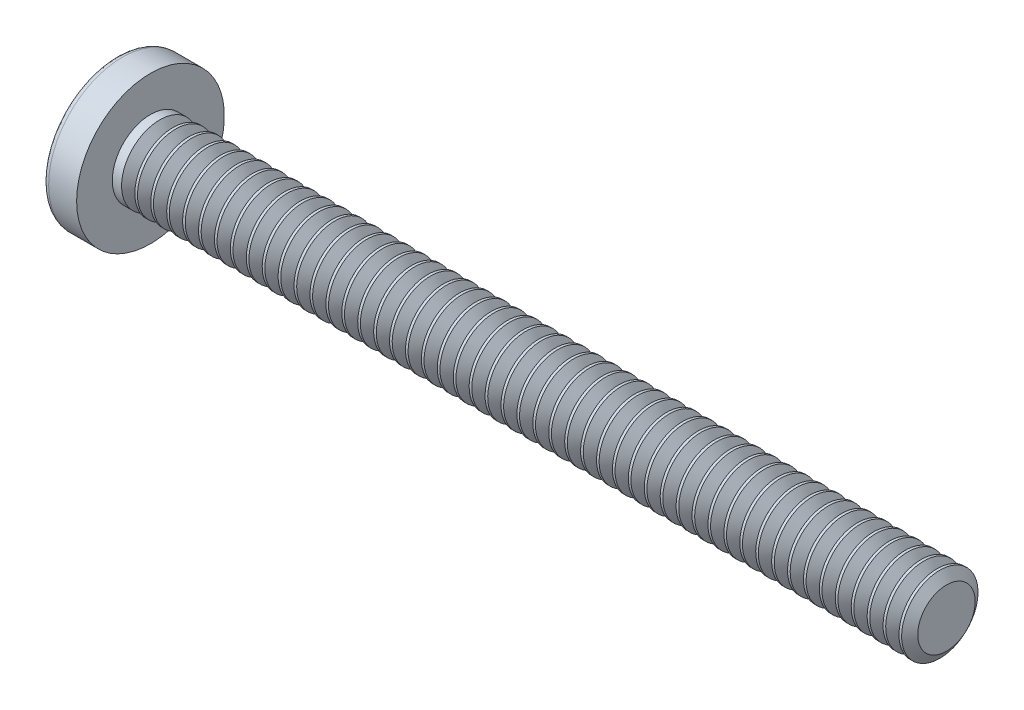
from build123d import *

# Parameters (mm, degrees)
CIRPATTERN1_COUNT = 2
CIRPATTERN1_ANGLE = 90
THDSCHPAT_COUNT   = 50
THDSCHPAT_PITCH   = 0.3175


with BuildPart() as part:
    # BodySke → Base-Revolve (revolve)
    with BuildSketch(Plane.XY, mode=Mode.PRIVATE) as base_revolve_sk:
        with BuildLine():
            Line((1.1176, 0.762), (1.1176, 1.4732))
            Line((1.1176, 1.4732), (0.559486612, 1.4732))
            ThreePointArc((0.559486612, 1.4732), (0.501455643, 1.459166396), (0.456249613, 1.420167033))
            ThreePointArc((0.456249613, 1.420167033), (0.116862787, 0.745828082), (0, 0))
            Line((0, 0), (16.9926, 0))
            Line((16.9926, 0), (16.9926, 0.762))
            Line((16.9926, 0.762), (1.1176, 0.762))
        make_face()
    revolve(base_revolve_sk.sketch.rotate(Axis((-25.4, 0, 0), (1, 0, 0)), 90), axis=Axis((-25.4, 0, 0), (1, 0, 0)))

    # Sketch3 → Cut-Loft1 section 0
    with BuildSketch(Plane(origin=(0, 0, 0), x_dir=(0, 0, -1), z_dir=(1, 0, 0))):
        with BuildLine():
            Line((0.2794, -0.9652), (-0.2794, -0.9652))
            Line((-0.2794, -0.9652), (-0.2794, 0.9652))
            Line((-0.2794, 0.9652), (0.2794, 0.9652))
            Line((0.2794, 0.9652), (0.2794, -0.9652))
        make_face()
    # Sketch4 → Cut-Loft1 section 1
    with BuildSketch(Plane(origin=(0.9652, 0, 0), x_dir=(0, 0, -1), z_dir=(1, 0, 0))):
        with BuildLine():
            Line((0.1397, -0.1397), (-0.1397, -0.1397))
            Line((-0.1397, -0.1397), (-0.1397, 0.1397))
            Line((-0.1397, 0.1397), (0.1397, 0.1397))
            Line((0.1397, 0.1397), (0.1397, -0.1397))
        make_face()
    cut_loft1 = loft(mode=Mode.SUBTRACT)

    # CirPattern1: Cut-Loft1 ×2 about axis
    cirpattern1_axis = Axis((0, 0, 0), (1, 0, 0))
    for i in range(1, CIRPATTERN1_COUNT):
        add(cut_loft1.rotate(cirpattern1_axis, i * CIRPATTERN1_ANGLE / (CIRPATTERN1_COUNT - 1)), mode=Mode.SUBTRACT)

    # ThdSchSke → ThreadSchematic (revolve, cut)
    with BuildSketch(Plane.XY, mode=Mode.PRIVATE) as threadschematic_sk:
        Polygon((1.4351, -0.57277), (1.302599728, -0.762), (1.302599728, -0.9525), (1.567600272, -0.9525), (1.567600272, -0.762), align=None)
    threadschematic = revolve(threadschematic_sk.sketch.rotate(Axis((-3.175, 0, 0), (1, 0, 0)), 270), axis=Axis((-3.175, 0, 0), (1, 0, 0)), mode=Mode.SUBTRACT)

    # ThdSchPat: ThreadSchematic ×50
    with Locations(*[(i * THDSCHPAT_PITCH, 0, 0) for i in range(1, THDSCHPAT_COUNT)]):
        add(threadschematic, mode=Mode.SUBTRACT)


solid = part.part
